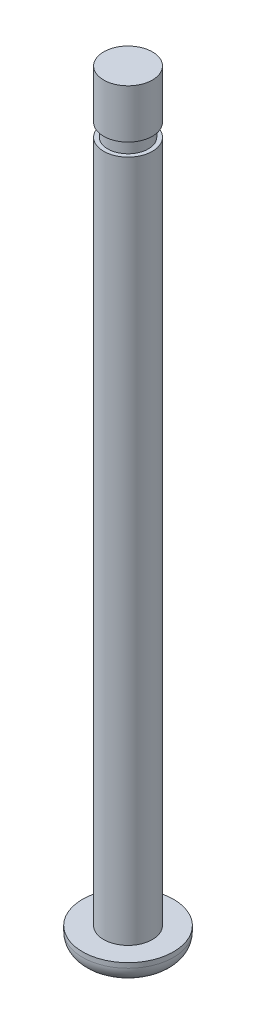
from build123d import *

# Parameters (mm, degrees)
SKETCH_1_R      = 1.5
EXTRUDE_1_DEPTH = 42
SKETCH_2_R      = 1.25
EXTRUDE_2_DEPTH = 0.8
SKETCH_3_R      = 1.5
EXTRUDE_3_DEPTH = 3
SKETCH_4_R      = 2.8
EXTRUDE_4_DEPTH = 1.3
FILLET_1_R      = 1


with BuildPart() as part:
    # 草图1 → 凸台-拉伸1 (new body)
    with BuildSketch(Plane(origin=(0, 0, 0), x_dir=(1, 0, 0), z_dir=(0, 1, 0))):
        with Locations(Location((0, 0, 0), (0, 0, 90))):
            Circle(SKETCH_1_R)
    extrude(amount=EXTRUDE_1_DEPTH)

    # 草图2 → 凸台-拉伸2 (add)
    with BuildSketch(Plane(origin=(0, 42, 0), x_dir=(1, 0, 0), z_dir=(0, 1, 0))):
        with Locations(Location((0, 0, 0), (0, 0, 270))):
            Circle(SKETCH_2_R)
    extrude(amount=EXTRUDE_2_DEPTH)

    # 草图3 → 凸台-拉伸3 (add)
    with BuildSketch(Plane(origin=(0, 42.8, 0), x_dir=(1, 0, 0), z_dir=(0, 1, 0))):
        with Locations(Location((0, 0, 0), (0, 0, 90))):
            Circle(SKETCH_3_R)
    extrude(amount=EXTRUDE_3_DEPTH)

    # 草图4 → 凸台-拉伸4 (add)
    with BuildSketch(Plane.XZ):
        with Locations(Location((0, 0, 0), (0, 0, 270))):
            Circle(SKETCH_4_R)
    extrude(amount=EXTRUDE_4_DEPTH)

    # 圆角1
    fillet_1_edges = [part.edges().sort_by_distance(p)[0] for p in [
        (0, -1.3, 2.8),
    ]]
    fillet(fillet_1_edges, radius=FILLET_1_R)


solid = part.part
